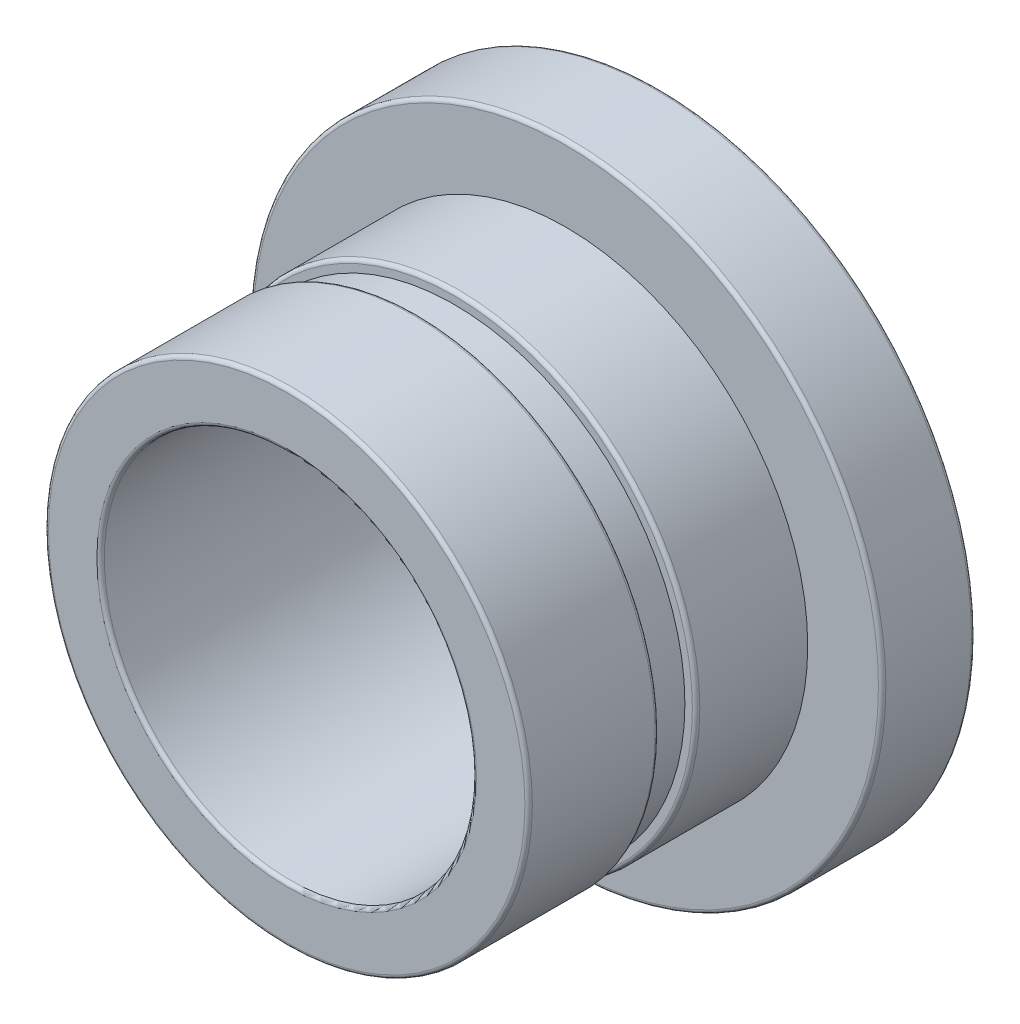
from build123d import *

# Parameters (mm, degrees)
SKETCH1_R          = 8.5
EXTRUDE1_DEPTH     = 2.5
SKETCH2_R          = 6.5
EXTRUDE2_DEPTH     = 7.5
SKETCH3_R          = 5
CUT_EXTRUDE1_DEPTH = 16.636495771
FILLET1_R          = 0.1
CUT_EXTRUDE2_START = -4.5
SKETCH4_R          = 6.5
SKETCH4_R_2        = 6.2
CUT_EXTRUDE2_DEPTH = 1
FILLET2_R          = 0.1


with BuildPart() as part:
    # Sketch1 → Extrude1 (new body)
    with BuildSketch(Plane.XY):
        Circle(SKETCH1_R)
    extrude(amount=EXTRUDE1_DEPTH)

    # Sketch2 → Extrude2 (add)
    with BuildSketch(Plane.XY.offset(2.5)):
        Circle(SKETCH2_R)
    extrude(amount=EXTRUDE2_DEPTH)

    # Sketch3 → Cut-Extrude1 (cut, through all)
    with BuildSketch(Plane.XY.offset(10)):
        Circle(SKETCH3_R)
    extrude(amount=-CUT_EXTRUDE1_DEPTH, mode=Mode.SUBTRACT)

    # Fillet1
    fillet1_edges = [part.edges().sort_by_distance(p)[0] for p in [
        (-5, 0, 0),
        (-5, 0, 10),
        (-8.5, 0, 0),
        (-8.5, 0, 2.5),
        (-6.5, 0, 10),
    ]]
    fillet(fillet1_edges, radius=FILLET1_R)

    # Sketch4 → Cut-Extrude2 (cut)
    with BuildSketch(Plane.XY.offset(10).offset(CUT_EXTRUDE2_START)):
        Circle(SKETCH4_R)
        Circle(SKETCH4_R_2, mode=Mode.SUBTRACT)
    extrude(amount=CUT_EXTRUDE2_DEPTH, mode=Mode.SUBTRACT)

    # Fillet2
    fillet2_edges = [part.edges().sort_by_distance(p)[0] for p in [
        (-6.5, 0, 5.5),
        (-6.5, 0, 6.5),
    ]]
    fillet(fillet2_edges, radius=FILLET2_R)


solid = part.part
